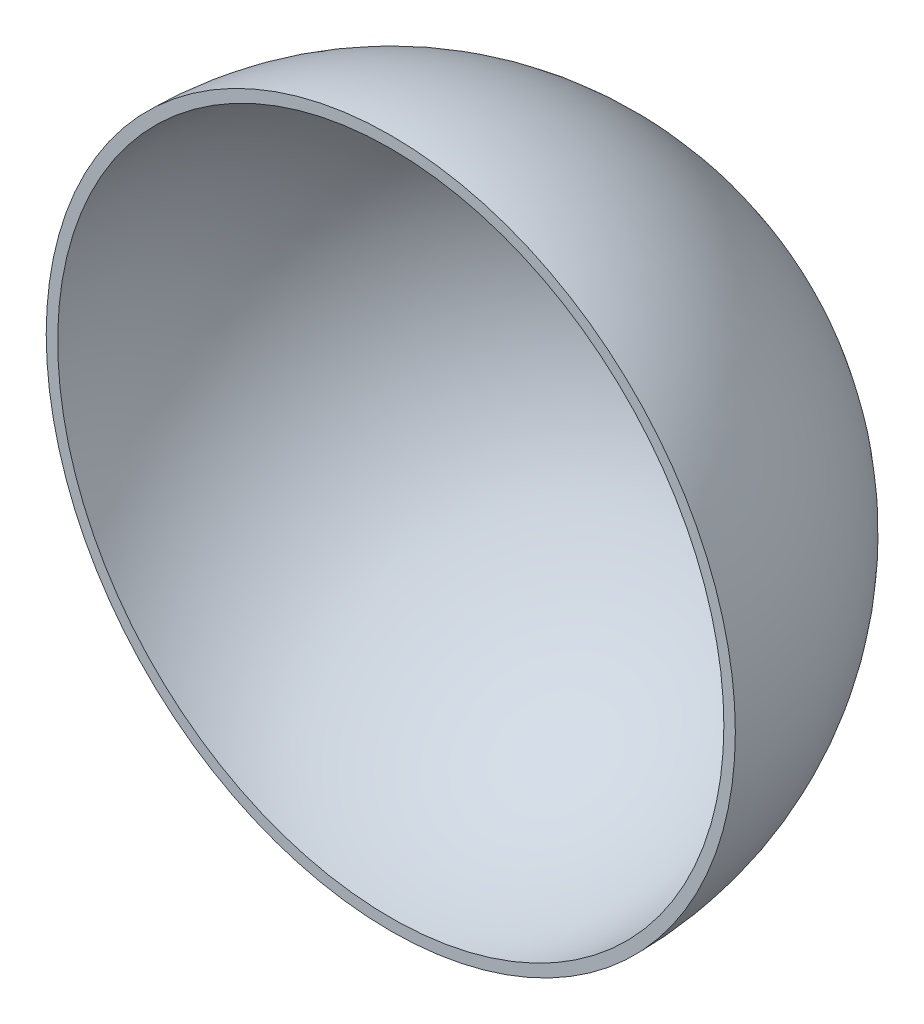
from build123d import *


with BuildPart() as part:
    # Sketch2 → Revolve1 (revolve)
    with BuildSketch(Plane(origin=(0, 0, 0), x_dir=(0, 0, -1), z_dir=(1, 0, 0))):
        with BuildLine():
            ThreePointArc((30, 0), (21.213203436, 21.213203436), (0, 30))
            Line((0, 30), (0, 29))
            ThreePointArc((0, 29), (20.506096654, 20.506096654), (29, 0))
            Line((29, 0), (30, 0))
        make_face()
    revolve(axis=Axis((0, 0, 0), (0, 0, -1)))


solid = part.part
